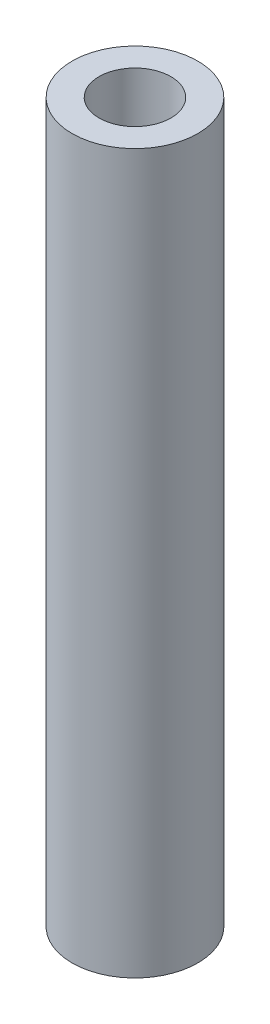
from build123d import *

# Parameters (mm, degrees)
CROQUIS1_R              = 3.5
CROQUIS1_R_2            = 2
SALIENTE_EXTRUIR1_DEPTH = 40


with BuildPart() as part:
    # Croquis1 → Saliente-Extruir1 (new body)
    with BuildSketch(Plane(origin=(0, 0, 0), x_dir=(1, 0, 0), z_dir=(0, 1, 0))):
        with Locations(Location((0, 0, 0), (0, 0, 270))):
            Circle(CROQUIS1_R)
        with Locations(Location((0, 0, 0), (0, 0, 270))):
            Circle(CROQUIS1_R_2, mode=Mode.SUBTRACT)
    extrude(amount=SALIENTE_EXTRUIR1_DEPTH)


solid = part.part
